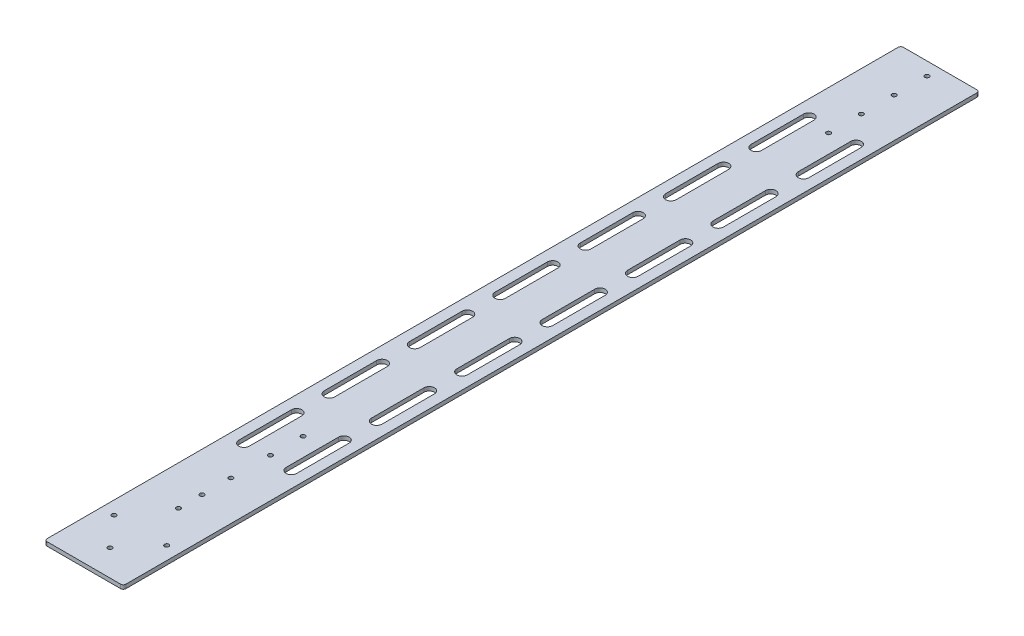
from build123d import *

# Parameters (mm, degrees)
SKETCH_1_W             = 60
SKETCH_1_H             = 652
EXTRUDE_1_DEPTH        = 3
SKETCH_2_R             = 1.65
CUT_EXTRUDE_1_DEPTH    = 3
FILLET_1_R             = 2
SKETCH_4_R             = 1.65
CUT_EXTRUDE_2_DEPTH    = 10
CUT_EXTRUDE_3_DEPTH    = 3
PATTERN_LINEAR_2_COUNT = 7
PATTERN_LINEAR_2_PITCH = 65
MIRROR_1_COPY_1_DEPTH  = 3
MIRROR_1_COPY_2_DEPTH  = 3
MIRROR_1_COPY_3_DEPTH  = 3
MIRROR_1_COPY_4_DEPTH  = 3
MIRROR_1_COPY_5_DEPTH  = 3
MIRROR_1_COPY_6_DEPTH  = 3
SKETCH_6_R             = 1.65
CUT_EXTRUDE_4_DEPTH    = 10


with BuildPart() as part:
    # 草图1 → 凸台-拉伸1 (new body)
    with BuildSketch(Plane(origin=(0, 0, 0), x_dir=(1, 0, 0), z_dir=(0, 1, 0))):
        Rectangle(SKETCH_1_W, SKETCH_1_H)
    extrude(amount=EXTRUDE_1_DEPTH)

    # 草图2 → 切除-拉伸1 (cut)
    with BuildSketch(Plane(origin=(0, 3, 0), x_dir=(1, 0, 0), z_dir=(0, 1, 0))):
        with Locations(Location((0, -306, 0), (0, 0, 270))):
            Circle(SKETCH_2_R)
        with Locations(Location((0, -236, 0), (0, 0, 270))):
            Circle(SKETCH_2_R)
        with Locations(Location((0, -184, 0), (0, 0, 270))):
            Circle(SKETCH_2_R)
        with Locations(Location((0, -159, 0), (0, 0, 270))):
            Circle(SKETCH_2_R)
        with Locations(Location((0, 316, 0), (0, 0, 270))):
            Circle(SKETCH_2_R)
        with Locations(Location((0, 291, 0), (0, 0, 270))):
            Circle(SKETCH_2_R)
        with Locations(Location((0, 266, 0), (0, 0, 270))):
            Circle(SKETCH_2_R)
        with Locations(Location((0, 241, 0), (0, 0, 270))):
            Circle(SKETCH_2_R)
    extrude(amount=-CUT_EXTRUDE_1_DEPTH, mode=Mode.SUBTRACT)

    # 圆角1
    fillet_1_edges = [part.edges().sort_by_distance(p)[0] for p in [
        (30, 1.5, 326),
        (-30, 1.5, 326),
        (-30, 1.5, -326),
        (30, 1.5, -326),
    ]]
    fillet(fillet_1_edges, radius=FILLET_1_R)

    # 草图4 → 切除-拉伸2 (cut)
    with BuildSketch(Plane(origin=(0, 3, 0), x_dir=(1, 0, 0), z_dir=(0, 1, 0))):
        with Locations(Location((20, -283, 0), (0, 0, 270))):
            Circle(SKETCH_4_R)
        with Locations(Location((-20, -283, 0), (0, 0, 270))):
            Circle(SKETCH_4_R)
    extrude(amount=-CUT_EXTRUDE_2_DEPTH, mode=Mode.SUBTRACT)

    # 草图5 → 切除-拉伸3 (cut)
    with BuildSketch(Plane(origin=(0, 3, 0), x_dir=(1, 0, 0), z_dir=(0, 1, 0))):
        with BuildLine():
            Line((14, -186), (14, -146))
            ThreePointArc((14, -146), (18, -142), (22, -146))
            Line((22, -146), (22, -186))
            ThreePointArc((22, -186), (18, -190), (14, -186))
        make_face()
    cut_extrude_3 = extrude(amount=-CUT_EXTRUDE_3_DEPTH, mode=Mode.SUBTRACT)

    # 阵列(线性)2: 切除-拉伸3 ×7
    with Locations(*[(0, 0, -i * PATTERN_LINEAR_2_PITCH) for i in range(1, PATTERN_LINEAR_2_COUNT)]):
        add(cut_extrude_3, mode=Mode.SUBTRACT)

    # 镜向1: 切除-拉伸3 across plane
    add(cut_extrude_3.mirror(Plane(origin=(0, 0, 0), x_dir=(0, 0, 1), z_dir=(1, 0, 0))), mode=Mode.SUBTRACT)

    # 镜向1 copy 1 sketch → 镜向1 copy 1 (cut)
    with BuildSketch(Plane(origin=(0, 3, -65), x_dir=(-1, 0, 0), z_dir=(0, 1, 0))):
        with BuildLine():
            Line((14, 186), (14, 146))
            ThreePointArc((14, 146), (18, 142), (22, 146))
            Line((22, 146), (22, 186))
            ThreePointArc((22, 186), (18, 190), (14, 186))
        make_face()
    extrude(amount=-MIRROR_1_COPY_1_DEPTH, mode=Mode.SUBTRACT)

    # 镜向1 copy 2 sketch → 镜向1 copy 2 (cut)
    with BuildSketch(Plane(origin=(0, 3, -130), x_dir=(-1, 0, 0), z_dir=(0, 1, 0))):
        with BuildLine():
            Line((14, 186), (14, 146))
            ThreePointArc((14, 146), (18, 142), (22, 146))
            Line((22, 146), (22, 186))
            ThreePointArc((22, 186), (18, 190), (14, 186))
        make_face()
    extrude(amount=-MIRROR_1_COPY_2_DEPTH, mode=Mode.SUBTRACT)

    # 镜向1 copy 3 sketch → 镜向1 copy 3 (cut)
    with BuildSketch(Plane(origin=(0, 3, -195), x_dir=(-1, 0, 0), z_dir=(0, 1, 0))):
        with BuildLine():
            Line((14, 186), (14, 146))
            ThreePointArc((14, 146), (18, 142), (22, 146))
            Line((22, 146), (22, 186))
            ThreePointArc((22, 186), (18, 190), (14, 186))
        make_face()
    extrude(amount=-MIRROR_1_COPY_3_DEPTH, mode=Mode.SUBTRACT)

    # 镜向1 copy 4 sketch → 镜向1 copy 4 (cut)
    with BuildSketch(Plane(origin=(0, 3, -260), x_dir=(-1, 0, 0), z_dir=(0, 1, 0))):
        with BuildLine():
            Line((14, 186), (14, 146))
            ThreePointArc((14, 146), (18, 142), (22, 146))
            Line((22, 146), (22, 186))
            ThreePointArc((22, 186), (18, 190), (14, 186))
        make_face()
    extrude(amount=-MIRROR_1_COPY_4_DEPTH, mode=Mode.SUBTRACT)

    # 镜向1 copy 5 sketch → 镜向1 copy 5 (cut)
    with BuildSketch(Plane(origin=(0, 3, -325), x_dir=(-1, 0, 0), z_dir=(0, 1, 0))):
        with BuildLine():
            Line((14, 186), (14, 146))
            ThreePointArc((14, 146), (18, 142), (22, 146))
            Line((22, 146), (22, 186))
            ThreePointArc((22, 186), (18, 190), (14, 186))
        make_face()
    extrude(amount=-MIRROR_1_COPY_5_DEPTH, mode=Mode.SUBTRACT)

    # 镜向1 copy 6 sketch → 镜向1 copy 6 (cut)
    with BuildSketch(Plane(origin=(0, 3, -390), x_dir=(-1, 0, 0), z_dir=(0, 1, 0))):
        with BuildLine():
            Line((14, 186), (14, 146))
            ThreePointArc((14, 146), (18, 142), (22, 146))
            Line((22, 146), (22, 186))
            ThreePointArc((22, 186), (18, 190), (14, 186))
        make_face()
    extrude(amount=-MIRROR_1_COPY_6_DEPTH, mode=Mode.SUBTRACT)

    # 草图6 → 切除-拉伸4 (cut)
    with BuildSketch(Plane.XZ):
        with Locations(Location((0, 254, 0), (0, 0, 270))):
            Circle(SKETCH_6_R)
        with Locations(Location((0, 214, 0), (0, 0, 270))):
            Circle(SKETCH_6_R)
    extrude(amount=-CUT_EXTRUDE_4_DEPTH, mode=Mode.SUBTRACT)


solid = part.part
